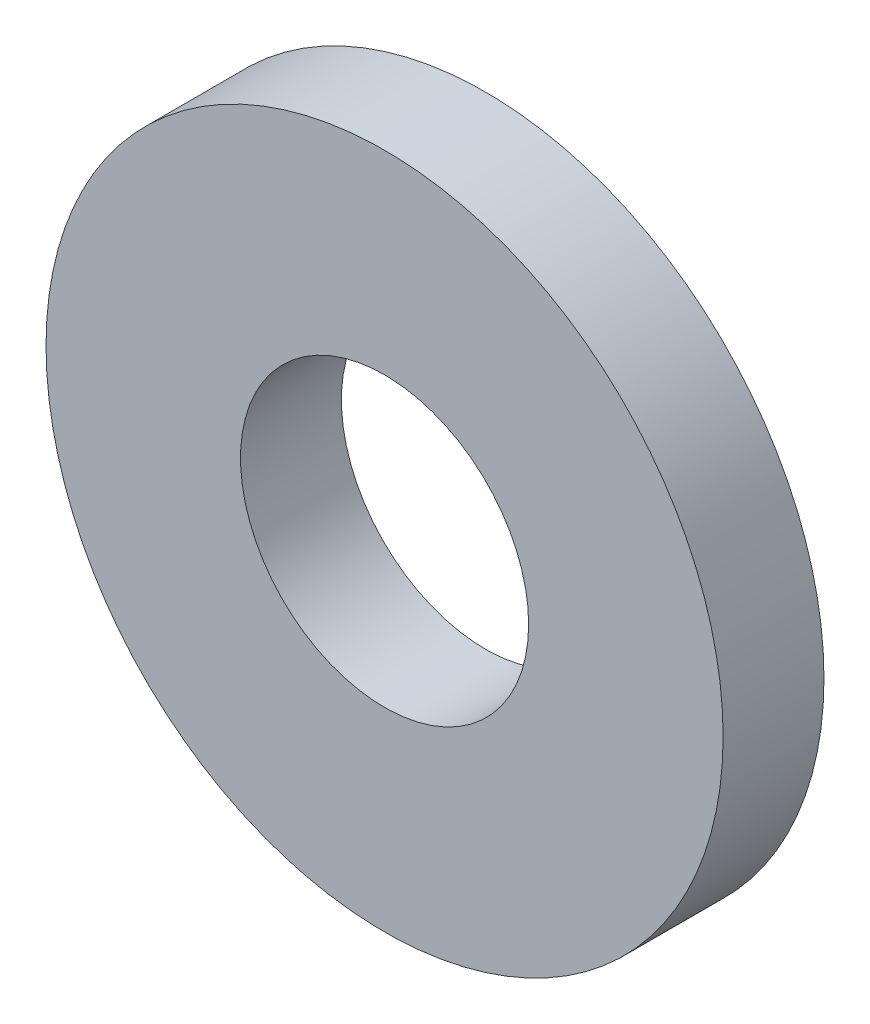
from build123d import *

# Parameters (mm, degrees)
SKETCH1_W = 13.5
SKETCH1_H = 7


with BuildPart() as part:
    # Sketch1 → Revolve1 (revolve)
    with BuildSketch(Plane(origin=(0, 0, 0), x_dir=(1, 0, 0), z_dir=(0, 1, 0))):
        with Locations((16.75, 0)):
            Rectangle(SKETCH1_W, SKETCH1_H)
    revolve(axis=Axis((0, 0, 0), (0, 0, -1)))


solid = part.part
